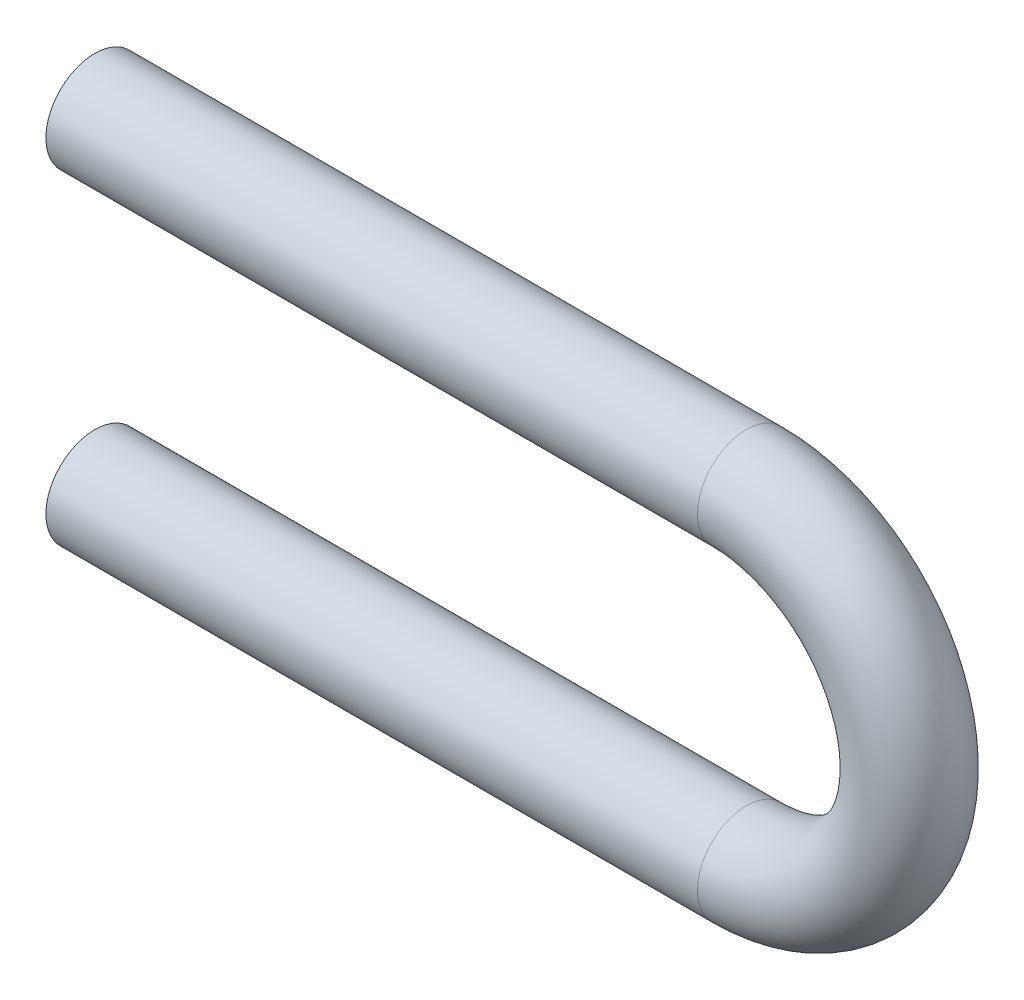
from build123d import *

# Parameters (mm, degrees)
SKETCH_2_R = 3


with BuildPart() as part:
    # По траектории1: sweep along a path in Эскиз1
    with BuildLine(Plane.XY) as sweep_1_path:
        Line((0, 0), (40, 0))
        ThreePointArc((40, 0), (50, 10), (40, 20))
        Line((40, 20), (0, 20))
    # Эскиз2 → По траектории1 (sweep)
    with BuildSketch(Plane(origin=(0, 0, 0), x_dir=(0, 0, -1), z_dir=(1, 0, 0))):
        Circle(SKETCH_2_R)
    sweep(path=sweep_1_path.line)


solid = part.part
